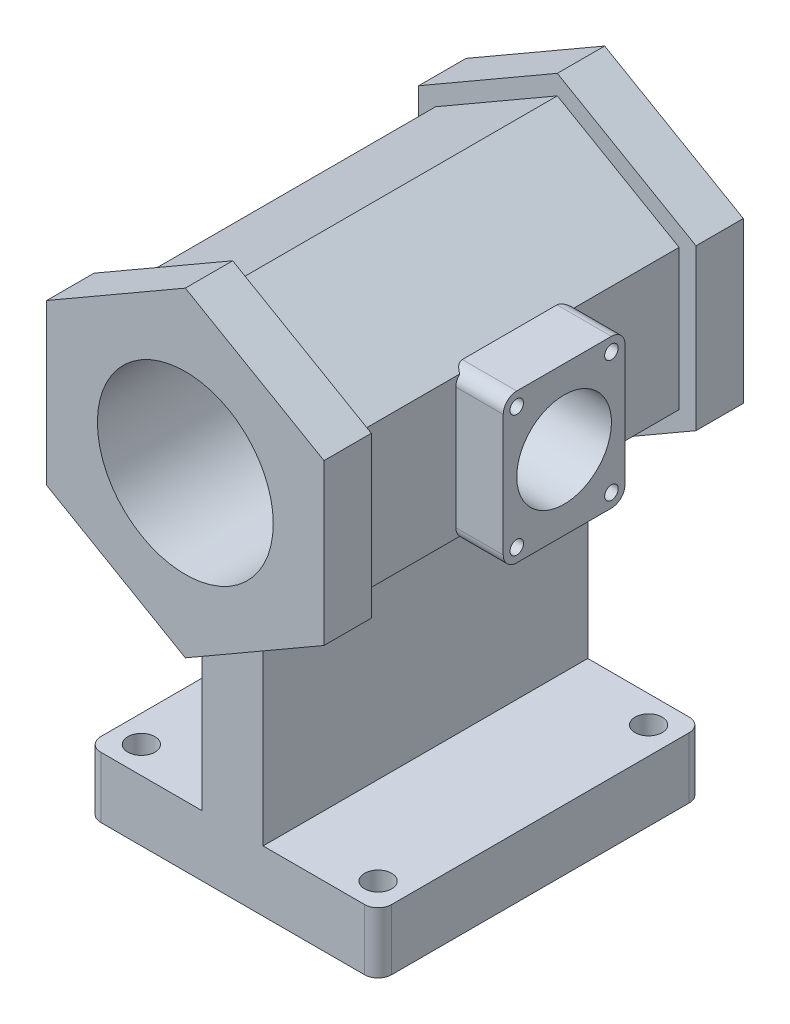
from build123d import *

# Parameters (mm, degrees)
EXTRUDE_1_DEPTH          = 240
EXTRUDE_2_DEPTH          = 35
EXTRUDE_4_DEPTH          = 35
EXTRUDE_5_DEPTH          = 35
EXTRUDE_5_DEPTH_BACK     = 90
SKETCH_5_W               = 90
SKETCH_5_H               = 110
SKETCH_6_R               = 65
CUT_EXTRUDE_1_DEPTH      = 443.521185934
CUT_EXTRUDE_2_REACH      = 464.365
CUT_EXTRUDE_2_END_RADIUS = 65
SKETCH_8_R               = 35
CUT_EXTRUDE_3_REACH      = 509.942
SKETCH_9_R               = 10
SKETCH_10_R              = 5
CUT_EXTRUDE_4_DEPTH      = 30
FILLET_1_R               = 10
FILLET_2_R               = 10


with BuildPart() as part:
    # Эскиз1 → Бобышка-Вытянуть1 (new body)
    with BuildSketch(Plane.XY):
        Polygon((0, 103.923048454), (-90, 51.961524227), (-90, -51.961524227), (-22.5, -90.932667397), (-22.5, -245), (-107.5, -245), (-107.5, -290), (107.5, -290), (107.5, -245), (22.5, -245), (22.5, -90.932667397), (90, -51.961524227), (90, 51.961524227), align=None)
    extrude(amount=EXTRUDE_1_DEPTH)

    # Эскиз2 → Бобышка-Вытянуть2 (add)
    with BuildSketch(Plane.XY.offset(240)):
        Polygon((0, 118.356805184), (-102.5, 59.178402592), (-102.5, -59.178402592), (0, -118.356805184), (102.5, -59.178402592), (102.5, 59.178402592), align=None)
    extrude(amount=EXTRUDE_2_DEPTH)

    # Эскиз4 → Бобышка-Вытянуть4 (add)
    with BuildSketch(Plane(origin=(0, 0, 0), x_dir=(-1, 0, 0), z_dir=(0, 0, -1))):
        Polygon((0, 118.356805184), (-102.5, 59.178402592), (-102.5, -59.178402592), (0, -118.356805184), (102.5, -59.178402592), (102.5, 59.178402592), align=None)
    extrude(amount=EXTRUDE_4_DEPTH)

    # Эскиз5 → Бобышка-Вытянуть5 (add, two sides: drawn at the far end of the back side and taken through both)
    with BuildSketch(Plane(origin=(90, 0, 0), x_dir=(0, 0, -1), z_dir=(1, 0, 0)).offset(-EXTRUDE_5_DEPTH_BACK)):
        with Locations((-120, 0)):
            Rectangle(SKETCH_5_W, SKETCH_5_H)
    extrude(amount=EXTRUDE_5_DEPTH + EXTRUDE_5_DEPTH_BACK)

    # Эскиз6 → Вырез-Вытянуть1 (cut, through all)
    with BuildSketch(Plane.XY.offset(275)):
        Circle(SKETCH_6_R)
    extrude(amount=-CUT_EXTRUDE_1_DEPTH, mode=Mode.SUBTRACT)

    # Вырез-Вытянуть2: up to this cylinder (the profile starts outside it)
    cut_extrude_2_end = Plane(origin=(0, 0, 120), z_dir=(0, 0, 1)) * Cylinder(CUT_EXTRUDE_2_END_RADIUS, 1059.73, mode=Mode.PRIVATE)
    # Эскиз8 → Вырез-Вытянуть2 (cut, up to the surface)
    with BuildSketch(Plane(origin=(125, 0, 0), x_dir=(0, 0, -1), z_dir=(1, 0, 0)), mode=Mode.PRIVATE) as cut_extrude_2_sk1:
        with Locations(Location((-120, 0, 0), (0, 0, 90))):
            Circle(SKETCH_8_R)
    cut_extrude_2_tool1 = extrude(cut_extrude_2_sk1.sketch, amount=-CUT_EXTRUDE_2_REACH, mode=Mode.PRIVATE) - cut_extrude_2_end
    add(cut_extrude_2_tool1.solids().sort_by_distance((125, 0, 120))[0], mode=Mode.SUBTRACT)

    # Эскиз9 → Вырез-Вытянуть3 (cut, up to next)
    with BuildSketch(Plane.XZ.offset(290), mode=Mode.PRIVATE) as cut_extrude_3_sk1:
        with Locations(Location((87.5, 220, 0), (0, 0, 270))):
            Circle(SKETCH_9_R)
    cut_extrude_3_tool1 = extrude(cut_extrude_3_sk1.sketch, amount=-CUT_EXTRUDE_3_REACH, mode=Mode.PRIVATE) & part.part
    # Эскиз9 → Вырез-Вытянуть3 (cut, up to next)
    with BuildSketch(Plane.XZ.offset(290), mode=Mode.PRIVATE) as cut_extrude_3_sk2:
        with Locations(Location((-87.5, 220, 0), (0, 0, 270))):
            Circle(SKETCH_9_R)
    cut_extrude_3_tool2 = extrude(cut_extrude_3_sk2.sketch, amount=-CUT_EXTRUDE_3_REACH, mode=Mode.PRIVATE) & part.part
    # Эскиз9 → Вырез-Вытянуть3 (cut, up to next)
    with BuildSketch(Plane.XZ.offset(290), mode=Mode.PRIVATE) as cut_extrude_3_sk3:
        with Locations(Location((87.5, 20, 0), (0, 0, 270))):
            Circle(SKETCH_9_R)
    cut_extrude_3_tool3 = extrude(cut_extrude_3_sk3.sketch, amount=-CUT_EXTRUDE_3_REACH, mode=Mode.PRIVATE) & part.part
    # Эскиз9 → Вырез-Вытянуть3 (cut, up to next)
    with BuildSketch(Plane.XZ.offset(290), mode=Mode.PRIVATE) as cut_extrude_3_sk4:
        with Locations(Location((-87.5, 20, 0), (0, 0, 270))):
            Circle(SKETCH_9_R)
    cut_extrude_3_tool4 = extrude(cut_extrude_3_sk4.sketch, amount=-CUT_EXTRUDE_3_REACH, mode=Mode.PRIVATE) & part.part
    add(cut_extrude_3_tool1.solids().sort_by_distance((87.5, -290, 220))[0], mode=Mode.SUBTRACT)
    add(cut_extrude_3_tool2.solids().sort_by_distance((-87.5, -290, 220))[0], mode=Mode.SUBTRACT)
    add(cut_extrude_3_tool3.solids().sort_by_distance((87.5, -290, 20))[0], mode=Mode.SUBTRACT)
    add(cut_extrude_3_tool4.solids().sort_by_distance((-87.5, -290, 20))[0], mode=Mode.SUBTRACT)

    # Эскиз10 → Вырез-Вытянуть4 (cut)
    with BuildSketch(Plane(origin=(125, 0, 0), x_dir=(0, 0, -1), z_dir=(1, 0, 0))):
        with Locations(Location((-155, -45, 0), (0, 0, 90))):
            Circle(SKETCH_10_R)
        with Locations(Location((-155, 45, 0), (0, 0, 90))):
            Circle(SKETCH_10_R)
        with Locations(Location((-85, 45, 0), (0, 0, 90))):
            Circle(SKETCH_10_R)
        with Locations(Location((-85, -45, 0), (0, 0, 90))):
            Circle(SKETCH_10_R)
    extrude(amount=-CUT_EXTRUDE_4_DEPTH, mode=Mode.SUBTRACT)

    # Скругление1
    fillet_1_edges = [part.edges().sort_by_distance(p)[0] for p in [
        (104.868602792, -55, 165),
        (104.868602792, -55, 75),
        (104.868602792, 55, 75),
        (104.868602792, 55, 165),
    ]]
    fillet(fillet_1_edges, radius=FILLET_1_R)

    # Скругление2
    fillet_2_edges = [part.edges().sort_by_distance(p)[0] for p in [
        (107.5, -267.5, 0),
        (-107.5, -267.5, 0),
        (-107.5, -267.5, 240),
        (107.5, -267.5, 240),
    ]]
    fillet(fillet_2_edges, radius=FILLET_2_R)


solid = part.part
